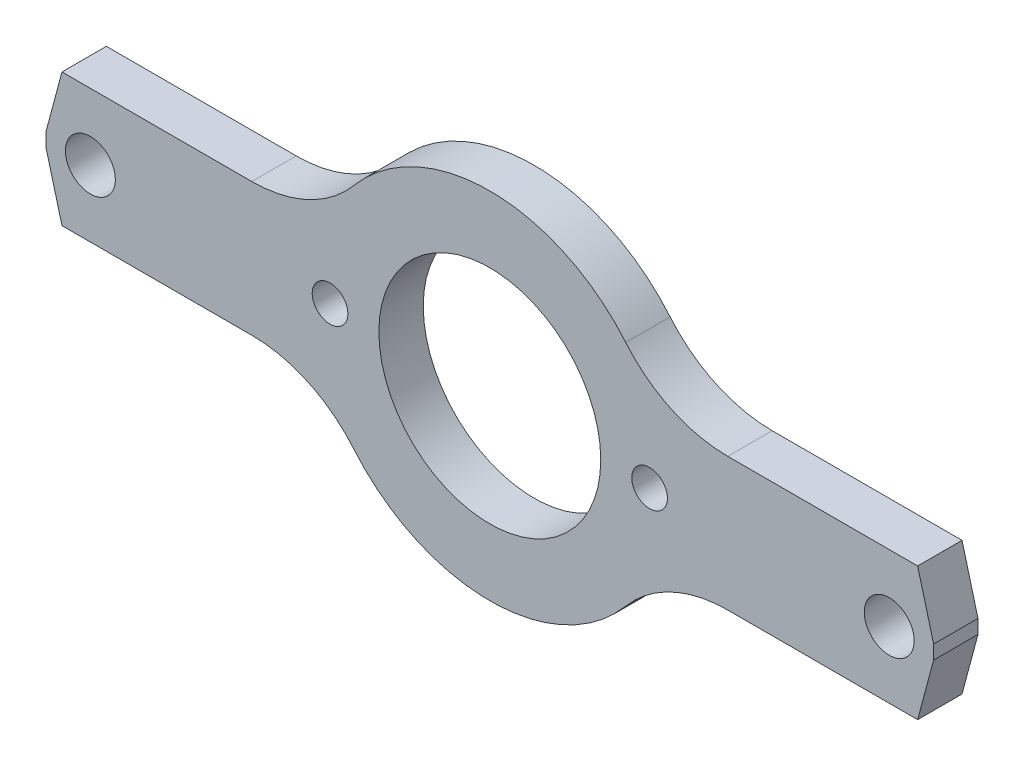
from build123d import *
from OCP.BRepFilletAPI import BRepFilletAPI_MakeChamfer

# Parameters (mm, degrees)
SKETCH1_R                   = 15.875
EXTRUDE1_DEPTH              = 6.35
CHAMFER1_SIZE               = 2.286
CHAMFER1_SIZE2              = 8.531468146
F_1_4_CLEARANCE_HOLE1_D     = 7.14248
F_1_4_20_TAPPED_HOLE1_D     = 5.1054
F_1_4_20_TAPPED_HOLE1_DEPTH = 16.51
F_1_4_20_TAPPED_HOLE1_TIP   = 1.533816902
FILLET1_R                   = 19.05


with BuildPart() as part:
    # Sketch1 → Extrude1 (new body)
    with BuildSketch(Plane.XY):
        with BuildLine():
            Line((0, 0), (0, -19.05))
            Line((0, -19.05), (39.953569803, -19.05))
            ThreePointArc((39.953569803, -19.05), (63.5, -34.925), (87.046430197, -19.05))
            Line((87.046430197, -19.05), (127, -19.05))
            Line((127, -19.05), (127, 0))
            Line((127, 0), (87.046430197, 0))
            ThreePointArc((87.046430197, 0), (63.5, 15.875), (39.953569803, 0))
            Line((39.953569803, 0), (0, 0))
        make_face()
        with Locations((63.5, -9.525)):
            Circle(SKETCH1_R, mode=Mode.SUBTRACT)
    extrude(amount=EXTRUDE1_DEPTH)

    # Chamfer1: one chamfer whose edges measure the first distance from different faces: ONE call of the kernel's chamfer builder (chamfer() names one face for all edges)
    chamfer1_edges_1 = [part.edges().sort_by_distance(p)[0] for p in [
        (127, 0, 3.175),
    ]]
    chamfer1_side_1 = [part.faces().sort_by_distance(p)[0] for p in [
        (107.023215098, 0, 3.175),
    ]]
    chamfer1_edges_2 = [part.edges().sort_by_distance(p)[0] for p in [
        (127, -19.05, 3.175),
    ]]
    chamfer1_side_2 = [part.faces().sort_by_distance(p)[0] for p in [
        (107.023215098, -19.05, 3.175),
    ]]
    chamfer1_edges_3 = [part.edges().sort_by_distance(p)[0] for p in [
        (0, -19.05, 3.175),
    ]]
    chamfer1_side_3 = [part.faces().sort_by_distance(p)[0] for p in [
        (19.976784902, -19.05, 3.175),
    ]]
    chamfer1_edges_4 = [part.edges().sort_by_distance(p)[0] for p in [
        (0, 0, 3.175),
    ]]
    chamfer1_side_4 = [part.faces().sort_by_distance(p)[0] for p in [
        (19.976784902, 0, 3.175),
    ]]
    chamfer1 = BRepFilletAPI_MakeChamfer(part.part.solid().wrapped)
    for e in chamfer1_edges_1:
        chamfer1.Add(CHAMFER1_SIZE, CHAMFER1_SIZE2, e.wrapped, chamfer1_side_1[0].wrapped)  # the first distance lies on this face
    for e in chamfer1_edges_2:
        chamfer1.Add(CHAMFER1_SIZE, CHAMFER1_SIZE2, e.wrapped, chamfer1_side_2[0].wrapped)  # the first distance lies on this face
    for e in chamfer1_edges_3:
        chamfer1.Add(CHAMFER1_SIZE, CHAMFER1_SIZE2, e.wrapped, chamfer1_side_3[0].wrapped)  # the first distance lies on this face
    for e in chamfer1_edges_4:
        chamfer1.Add(CHAMFER1_SIZE, CHAMFER1_SIZE2, e.wrapped, chamfer1_side_4[0].wrapped)  # the first distance lies on this face
    add(Compound.cast(chamfer1.Shape()), mode=Mode.REPLACE)

    # 1/4 Clearance Hole1 (through all)
    with Locations(Plane(origin=(6.35, -9.525, 6.35), x_dir=(1, 0, 0), z_dir=(0, 0, 1))):
        with Locations((0, 0), (114.3, 0)):
            Hole(F_1_4_CLEARANCE_HOLE1_D / 2)

    # 1/4-20 Tapped Hole1
    with Locations(Plane(origin=(40.64, -9.525, 0), x_dir=(-1, 0, 0), z_dir=(0, 0, -1))):
        with Locations((0, 0), (-45.72, 0)):
            Hole(F_1_4_20_TAPPED_HOLE1_D / 2, depth=F_1_4_20_TAPPED_HOLE1_DEPTH)
            with Locations((0, 0, -(F_1_4_20_TAPPED_HOLE1_DEPTH + F_1_4_20_TAPPED_HOLE1_TIP / 2))):  # 118° drill point
                Cone(0, F_1_4_20_TAPPED_HOLE1_D / 2, F_1_4_20_TAPPED_HOLE1_TIP, mode=Mode.SUBTRACT)

    # Fillet1
    fillet1_edges = [part.edges().sort_by_distance(p)[0] for p in [
        (39.953569803, 0, 3.175),
        (87.046430197, 0, 3.175),
        (87.046430197, -19.05, 3.175),
        (39.953569803, -19.05, 3.175),
    ]]
    fillet(fillet1_edges, radius=FILLET1_R)


solid = part.part
